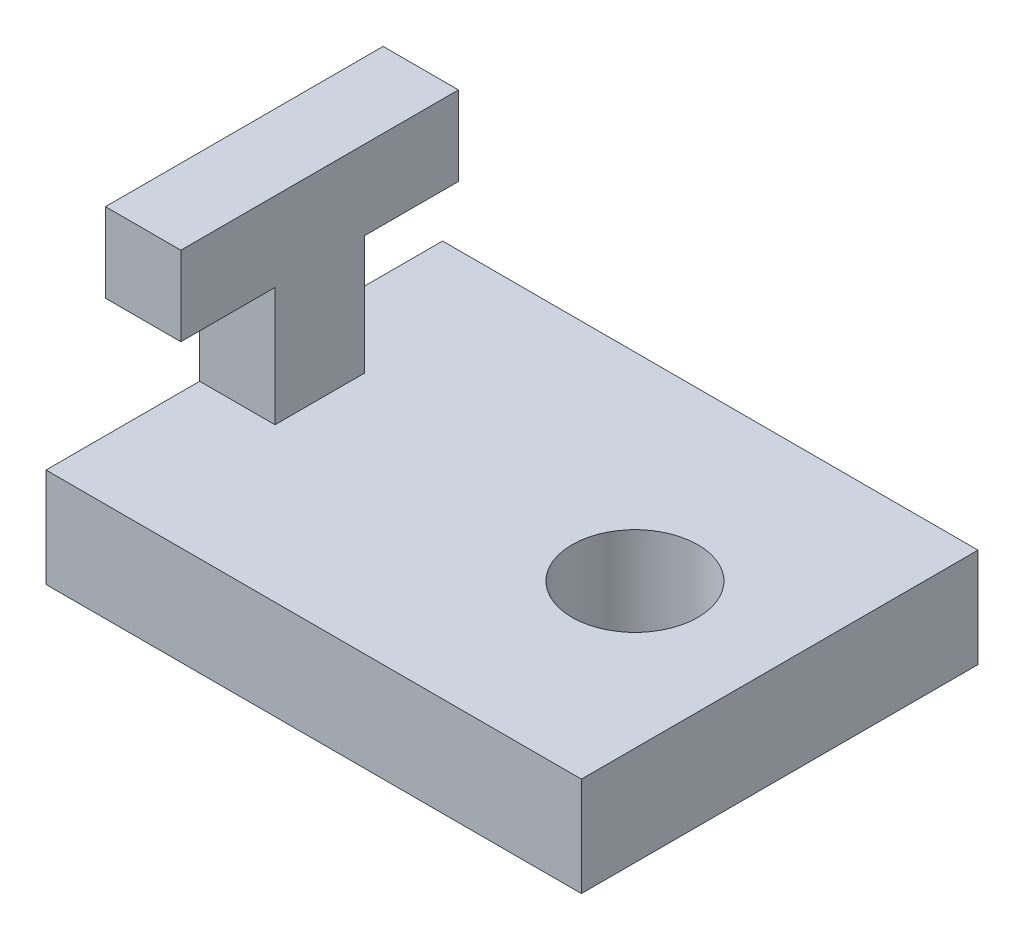
from build123d import *

# Parameters (mm, degrees)
SKETCH1_W           = 27
SKETCH1_H           = 20
BOSS_EXTRUDE1_DEPTH = 5
BOSS_EXTRUDE2_DEPTH = 3.8
SKETCH3_R           = 3.175
CUT_EXTRUDE1_DEPTH  = 10


with BuildPart() as part:
    # Sketch1 → Boss-Extrude1 (new body)
    with BuildSketch(Plane(origin=(0, 0, 0), x_dir=(1, 0, 0), z_dir=(0, 1, 0))):
        Rectangle(SKETCH1_W, SKETCH1_H)
    extrude(amount=BOSS_EXTRUDE1_DEPTH)

    # Sketch3 → Cut-Extrude1 (cut)
    with BuildSketch(Plane.XZ):
        with Locations(Location((6.2, 0, 0), (0, 0, 270))):
            Circle(SKETCH3_R)
    extrude(amount=-CUT_EXTRUDE1_DEPTH, mode=Mode.SUBTRACT)


with BuildPart() as body_2:
    # Sketch2 → Boss-Extrude2 (new body)
    with BuildSketch(Plane.ZY.offset(13.5)):
        Polygon((2.25, 5), (-2.25, 5), (-2.25, 11), (-7, 11), (-7, 15), (7, 15), (7, 11), (2.25, 11), align=None)
    extrude(amount=-BOSS_EXTRUDE2_DEPTH)


solid = Compound([part.part, body_2.part])
